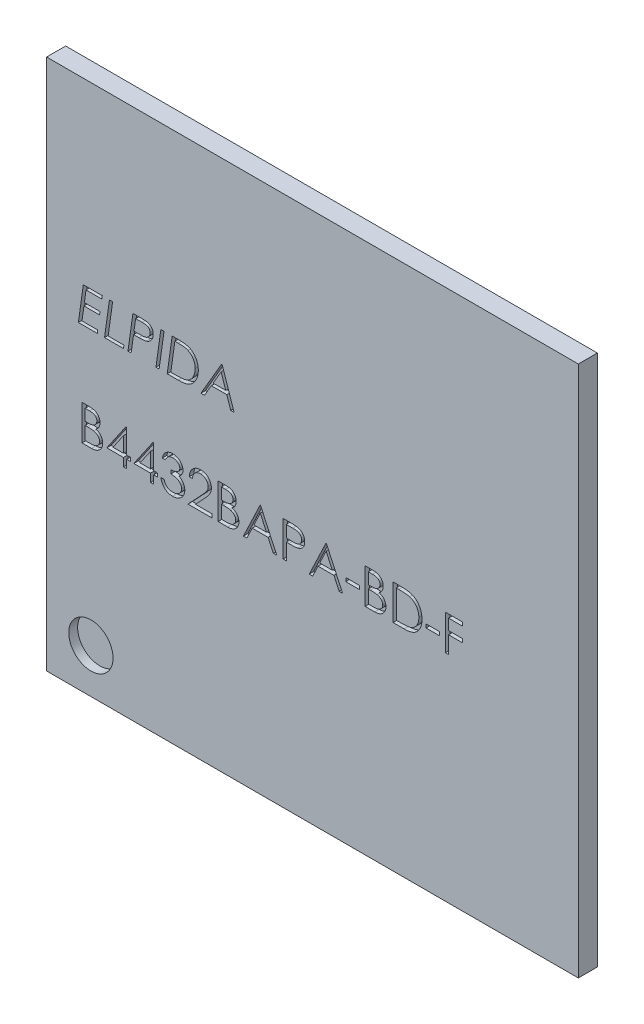
from build123d import *

# Parameters (mm, degrees)
SKETCH1_W           = 12
SKETCH1_H           = 12
BOSS_EXTRUDE1_DEPTH = 0.43
SKETCH5_R           = 0.5
CUT_EXTRUDE2_DEPTH  = 0.2
SKETCH4_W           = 0.305288462
SKETCH4_H           = 0.081410257
CUT_EXTRUDE1_DEPTH  = 0.1


with BuildPart() as part:
    # Sketch1 → Boss-Extrude1 (new body)
    with BuildSketch(Plane.XY):
        Rectangle(SKETCH1_W, SKETCH1_H)
    extrude(amount=BOSS_EXTRUDE1_DEPTH)

    # Sketch5 → Cut-Extrude2 (cut)
    with BuildSketch(Plane.XY.offset(0.43)):
        with Locations((-5, -5)):
            Circle(SKETCH5_R)
    extrude(amount=-CUT_EXTRUDE2_DEPTH, mode=Mode.SUBTRACT)

    # Sketch4 → Cut-Extrude1 (cut)
    # profile 1 of 20: a face of its own
    with BuildSketch(Plane.XY.offset(0.43)):
        Polygon((-4.743704935, 1.963617746), (-4.754994248, 1.892383771), (-5.110051089, 1.892383771), (-5.147099115, 1.627800438), (-4.794586345, 1.627800438), (-4.804762627, 1.556566464), (-5.157275397, 1.556566464), (-5.201319618, 1.24110172), (-4.845467755, 1.24110172), (-4.854690011, 1.169867746), (-5.283047883, 1.169867746), (-5.171744798, 1.963617746), align=None)
    # profile 2 of 20: a face of its own
    with BuildSketch(Plane.XY.offset(0.43)):
        Polygon((-4.58152044, 1.963617746), (-4.509650448, 1.963617746), (-4.611095259, 1.24110172), (-4.255243396, 1.24110172), (-4.264306647, 1.169867746), (-4.692823524, 1.169867746), align=None)
    # profile 3 of 20: a face of its own
    with BuildSketch(Plane.XY.offset(0.43)):
        with BuildLine():
            Line((-4.052353773, 1.963617746), (-3.84262696, 1.963617746))
            add(Edge.make_bspline(
                [(-3.84262696, 1.963617746), (-3.834251572, 1.963565486), (-3.818130989, 1.963464899), (-3.794910318, 1.962458826), (-3.773483707, 1.961071743), (-3.753882184, 1.95913798), (-3.736129443, 1.95619807), (-3.720256434, 1.952906663), (-3.706098841, 1.949213847), (-3.689950424, 1.943061618), (-3.671753119, 1.933628638), (-3.652183986, 1.919467172), (-3.63517565, 1.902059789), (-3.620323246, 1.882224392), (-3.608405471, 1.85982962), (-3.599943126, 1.835257794), (-3.59475202, 1.808805821), (-3.594113096, 1.790486229), (-3.593785063, 1.781080686)],
                knots=[0, 0, 0, 0, 1.135332684, 2.185238988, 3.150208107, 4.046040219, 4.854001743, 5.588181339, 6.243560949, 6.834748932, 7.927376448, 9.012417828, 10.094600696, 11.214043572, 12.361542901, 13.518161337, 14.725788303, 16, 16, 16, 16], degree=3))
            add(Edge.make_bspline(
                [(-3.593785063, 1.781080686), (-3.59388998, 1.774820536), (-3.594095973, 1.762529418), (-3.596239407, 1.744392989), (-3.599736032, 1.726909764), (-3.604523147, 1.71000449), (-3.61055108, 1.693615103), (-3.618196489, 1.677952312), (-3.627217571, 1.662908826), (-3.637281696, 1.648486412), (-3.64857898, 1.635096015), (-3.66051249, 1.62258808), (-3.673278391, 1.611263658), (-3.686810286, 1.601093808), (-3.701005, 1.592012742), (-3.715832489, 1.583968917), (-3.731529602, 1.57729534), (-3.742375043, 1.573666329), (-3.747860333, 1.571830887)],
                knots=[0, 0, 0, 0, 1.077613652, 2.115775993, 3.139637116, 4.14510796, 5.138576732, 6.142762576, 7.14141659, 8.156821813, 9.16766358, 10.155287502, 11.131543445, 12.102666116, 13.067290607, 14.031007908, 15.004144336, 16, 16, 16, 16], degree=3))
            add(Edge.make_bspline(
                [(-3.747860333, 1.571830887), (-3.752300896, 1.570618856), (-3.761856384, 1.56801073), (-3.777455417, 1.564849316), (-3.795370387, 1.5624562), (-3.815554057, 1.560124587), (-3.838165107, 1.558721735), (-3.863070085, 1.557330089), (-3.890273681, 1.556831253), (-3.909143923, 1.556657005), (-3.918949075, 1.556566464)],
                knots=[0, 0, 0, 0, 0.641206386, 1.379788876, 2.215232503, 3.158725674, 4.209900022, 5.370746801, 6.633815758, 8, 8, 8, 8], degree=3))
            Line((-3.918949075, 1.556566464), (-4.037725367, 1.556566464))
            Line((-4.037725367, 1.556566464), (-4.09194587, 1.169867746))
            Line((-4.09194587, 1.169867746), (-4.163656858, 1.169867746))
            Line((-4.163656858, 1.169867746), (-4.052353773, 1.963617746))
        make_face()
        with BuildLine():
            Line((-3.990660063, 1.892383771), (-4.02770809, 1.627800438))
            Line((-4.02770809, 1.627800438), (-3.916405005, 1.627800438))
            add(Edge.make_bspline(
                [(-3.916405005, 1.627800438), (-3.907394849, 1.627890427), (-3.890114406, 1.628063014), (-3.865242008, 1.628565752), (-3.842561892, 1.629946725), (-3.822019821, 1.631379898), (-3.80366729, 1.633619686), (-3.787500423, 1.636329094), (-3.77336409, 1.639199642), (-3.75767066, 1.644042743), (-3.74023586, 1.651684755), (-3.721605902, 1.663766731), (-3.705030221, 1.678525115), (-3.690946588, 1.695939194), (-3.679378954, 1.71511937), (-3.670995651, 1.735759863), (-3.665873257, 1.757456902), (-3.665305697, 1.772307823), (-3.665019037, 1.779808651)],
                knots=[0, 0, 0, 0, 1.292499712, 2.478866002, 3.567711026, 4.55136461, 5.4320969, 6.218239379, 6.902667729, 7.499057556, 8.571240445, 9.621392161, 10.671323708, 11.74113212, 12.821985709, 13.872330035, 14.925367204, 16, 16, 16, 16], degree=3))
            add(Edge.make_bspline(
                [(-3.665019037, 1.779808651), (-3.665217166, 1.785919446), (-3.665599438, 1.797709644), (-3.668988978, 1.814731814), (-3.674768765, 1.83024769), (-3.682551087, 1.844334234), (-3.692322827, 1.856699465), (-3.703935192, 1.867174808), (-3.717294165, 1.875699883), (-3.729950427, 1.881042416), (-3.741469524, 1.884339849), (-3.751819808, 1.886575987), (-3.763848377, 1.888182423), (-3.777454248, 1.889879899), (-3.792748404, 1.890820117), (-3.809646448, 1.891900373), (-3.828209026, 1.892281084), (-3.841143025, 1.892348623), (-3.847874105, 1.892383771)],
                knots=[0, 0, 0, 0, 1.185493767, 2.287297747, 3.351910597, 4.388303413, 5.399095946, 6.397186861, 7.410490164, 8.461641879, 9.051030142, 9.735191633, 10.515167525, 11.40603511, 12.396458938, 13.488902119, 14.693180664, 16, 16, 16, 16], degree=3))
            Line((-3.847874105, 1.892383771), (-3.990660063, 1.892383771))
        make_face(mode=Mode.SUBTRACT)
    # profile 4 of 20: a face of its own
    with BuildSketch(Plane.XY.offset(0.43)):
        Polygon((-3.421424286, 1.963617746), (-3.349713298, 1.963617746), (-3.461016383, 1.169867746), (-3.532727371, 1.169867746), align=None)
    # profile 5 of 20: a face of its own
    with BuildSketch(Plane.XY.offset(0.43)):
        with BuildLine():
            Line((-3.167017234, 1.963617746), (-3.002129664, 1.963617746))
            add(Edge.make_bspline(
                [(-3.002129664, 1.963617746), (-2.989459061, 1.963518111), (-2.964841844, 1.963324535), (-2.929091071, 1.961192203), (-2.895608084, 1.957922454), (-2.864403251, 1.953324953), (-2.835419977, 1.947578541), (-2.808778613, 1.940204876), (-2.784341554, 1.931773318), (-2.7621473, 1.921556197), (-2.74156167, 1.910124393), (-2.722047759, 1.897394447), (-2.703689823, 1.8830426), (-2.686169154, 1.867453704), (-2.670058974, 1.850101621), (-2.654468902, 1.831709558), (-2.640221451, 1.811595877), (-2.627053725, 1.790186764), (-2.615198275, 1.767648943), (-2.604586157, 1.744303167), (-2.595976768, 1.720037378), (-2.588483732, 1.695151292), (-2.583016884, 1.66934151), (-2.579059394, 1.642792241), (-2.5765938, 1.615444672), (-2.576304005, 1.59695877), (-2.576156858, 1.587572323)],
                knots=[0, 0, 0, 0, 1.407956197, 2.735462629, 3.978575056, 5.14562376, 6.239569826, 7.259868312, 8.215552976, 9.109099244, 9.971265144, 10.830589362, 11.695387039, 12.558759329, 13.433767108, 14.324435478, 15.23648578, 16.169930002, 17.115835343, 18.064962916, 19.017083207, 19.975070357, 20.951299687, 21.945924981, 22.957017783, 24, 24, 24, 24], degree=3))
            add(Edge.make_bspline(
                [(-2.576156858, 1.587572323), (-2.576353649, 1.577549605), (-2.576744818, 1.557627135), (-2.579469096, 1.528032425), (-2.584120456, 1.4990498), (-2.590450631, 1.470609824), (-2.598773773, 1.442803857), (-2.608754102, 1.415511792), (-2.620791434, 1.388908625), (-2.634343599, 1.363060989), (-2.649190898, 1.338355527), (-2.66512704, 1.315301545), (-2.681757047, 1.293874567), (-2.699505024, 1.274469086), (-2.717909481, 1.256733532), (-2.737251775, 1.240943397), (-2.757365607, 1.226864606), (-2.778556468, 1.214408107), (-2.801636338, 1.20379345), (-2.826969265, 1.194531557), (-2.855062414, 1.187089568), (-2.885625434, 1.18070832), (-2.918812697, 1.175826452), (-2.95463865, 1.172460696), (-2.993088301, 1.170111191), (-3.019616335, 1.169950566), (-3.033294528, 1.169867746)],
                knots=[0, 0, 0, 0, 1.023590641, 2.03462318, 3.032234983, 4.019795062, 5.008022507, 5.994484159, 6.985450496, 7.987853078, 8.973750197, 9.927208411, 10.848723504, 11.741556299, 12.6106407, 13.456920821, 14.288848772, 15.116061311, 15.963690692, 16.879848279, 17.867349015, 18.92897855, 20.067338715, 21.291093664, 22.603253266, 24, 24, 24, 24], degree=3))
            Line((-3.033294528, 1.169867746), (-3.278320319, 1.169867746))
            Line((-3.278320319, 1.169867746), (-3.167017234, 1.963617746))
        make_face()
        with BuildLine():
            Line((-3.105323524, 1.892383771), (-3.196592054, 1.24110172))
            Line((-3.196592054, 1.24110172), (-3.126948124, 1.24110172))
            add(Edge.make_bspline(
                [(-3.126948124, 1.24110172), (-3.11412186, 1.241151266), (-3.089581976, 1.241246061), (-3.054490193, 1.241435867), (-3.022743205, 1.242311401), (-2.99444104, 1.243261387), (-2.969458117, 1.244226106), (-2.94794898, 1.245909496), (-2.929734352, 1.247479882), (-2.918805789, 1.249111762), (-2.913882218, 1.249846963)],
                knots=[0, 0, 0, 0, 1.442493111, 2.759853895, 3.946400474, 5.013958638, 5.944757951, 6.757596782, 7.440268535, 8, 8, 8, 8], degree=3))
            add(Edge.make_bspline(
                [(-2.913882218, 1.249846963), (-2.90104897, 1.252348072), (-2.876133125, 1.257203993), (-2.840701032, 1.26851719), (-2.808578752, 1.283241786), (-2.783992991, 1.298042231), (-2.766123196, 1.311952753), (-2.753161899, 1.323425918), (-2.740808038, 1.336195994), (-2.728813282, 1.350068081), (-2.717380884, 1.365229239), (-2.706409062, 1.381559506), (-2.69615525, 1.399185761), (-2.686051774, 1.417606918), (-2.677162843, 1.437047971), (-2.669056699, 1.456987294), (-2.66249983, 1.477492826), (-2.656864502, 1.49832248), (-2.652546279, 1.519616434), (-2.649561273, 1.541338058), (-2.647789192, 1.563533119), (-2.647524441, 1.578452906), (-2.647390832, 1.585982279)],
                knots=[0, 0, 0, 0, 1.66921684, 3.240796505, 4.737423238, 6.174950648, 6.894049088, 7.627787166, 8.384256673, 9.161939998, 9.968982309, 10.808348516, 11.67339838, 12.573072656, 13.490905661, 14.402399116, 15.320906089, 16.23893884, 17.15777014, 18.094193054, 19.038221359, 20, 20, 20, 20], degree=3))
            add(Edge.make_bspline(
                [(-2.647390832, 1.585982279), (-2.647493433, 1.593884711), (-2.64769556, 1.609452691), (-2.649878069, 1.632383954), (-2.653129357, 1.654550978), (-2.657932604, 1.675963069), (-2.664137979, 1.696617951), (-2.67162925, 1.716537478), (-2.680341791, 1.735726205), (-2.690622176, 1.753953661), (-2.701750909, 1.771455499), (-2.714319999, 1.787682668), (-2.727574337, 1.802997358), (-2.741995482, 1.817014347), (-2.757300392, 1.829998262), (-2.773728961, 1.841712231), (-2.791097608, 1.852509182), (-2.803374092, 1.858612795), (-2.809575327, 1.861695921)],
                knots=[0, 0, 0, 0, 1.120622261, 2.207652496, 3.264547841, 4.296931978, 5.317338296, 6.321354955, 7.313791919, 8.303262802, 9.287578962, 10.252963919, 11.212004547, 12.158348376, 13.10268917, 14.056203162, 15.018127421, 16, 16, 16, 16], degree=3))
            add(Edge.make_bspline(
                [(-2.809575327, 1.861695921), (-2.815363009, 1.864195775), (-2.827620369, 1.869490057), (-2.848040269, 1.875458509), (-2.871048732, 1.88091625), (-2.896940624, 1.885077231), (-2.925537595, 1.888376874), (-2.956940666, 1.890705841), (-2.99109191, 1.892135982), (-3.014795505, 1.892299128), (-3.027093356, 1.892383771)],
                knots=[0, 0, 0, 0, 0.683593997, 1.447740037, 2.304372588, 3.249017606, 4.291364313, 5.427749439, 6.665470115, 8, 8, 8, 8], degree=3))
            Line((-3.027093356, 1.892383771), (-3.105323524, 1.892383771))
        make_face(mode=Mode.SUBTRACT)
    # profile 6 of 20: a face of its own
    with BuildSketch(Plane.XY.offset(0.43)):
        Polygon((-2.037767936, 1.963617746), (-1.769686505, 1.169867746), (-1.844259572, 1.169867746), (-1.933779053, 1.434451079), (-2.283111736, 1.434451079), (-2.436868997, 1.169867746), (-2.517643236, 1.169867746), (-2.056053442, 1.963617746), align=None)
        Polygon((-2.062254614, 1.814630616), (-2.24177059, 1.505685053), (-1.957947723, 1.505685053), align=None, mode=Mode.SUBTRACT)
    # profile 7 of 20: a face of its own
    with BuildSketch(Plane.XY.offset(0.43)):
        with BuildLine():
            Line((-5.201637627, -0.349122639), (-5.046767335, -0.349122639))
            add(Edge.make_bspline(
                [(-5.046767335, -0.349122639), (-5.039186233, -0.349162497), (-5.024492172, -0.349239751), (-5.003124549, -0.350437889), (-4.983110979, -0.352071579), (-4.964445659, -0.35466376), (-4.947137214, -0.357791538), (-4.931133482, -0.361579272), (-4.916485354, -0.366121022), (-4.898997287, -0.373343303), (-4.879058137, -0.384075522), (-4.857468502, -0.399934321), (-4.839007183, -0.419331862), (-4.823089929, -0.44121275), (-4.810435032, -0.465282827), (-4.801279852, -0.490968393), (-4.795483691, -0.517938145), (-4.7948876, -0.536453652), (-4.794586345, -0.54581109)],
                knots=[0, 0, 0, 0, 1.001505555, 1.941167018, 2.826882275, 3.653841531, 4.429895133, 5.150066043, 5.825578002, 6.45369114, 7.647487171, 8.808567382, 9.977351308, 11.170798116, 12.373658725, 13.556498008, 14.765093433, 16, 16, 16, 16], degree=3))
            add(Edge.make_bspline(
                [(-4.794586345, -0.54581109), (-4.794834271, -0.554576938), (-4.79532147, -0.571802655), (-4.799980274, -0.596997212), (-4.807273854, -0.620980077), (-4.817412366, -0.643663725), (-4.830589069, -0.664535634), (-4.846205152, -0.683764175), (-4.865045784, -0.700535218), (-4.879161662, -0.709911198), (-4.886331888, -0.714673771)],
                knots=[0, 0, 0, 0, 1.044552857, 2.05264487, 3.044412934, 4.028983338, 5.005914585, 5.980388656, 6.974128949, 8, 8, 8, 8], degree=3))
            add(Edge.make_bspline(
                [(-4.886331888, -0.714673771), (-4.877314791, -0.718135654), (-4.860062851, -0.724759095), (-4.836321559, -0.736469281), (-4.815866656, -0.749206045), (-4.798540875, -0.763115233), (-4.783723228, -0.778107767), (-4.770784436, -0.79440348), (-4.759744196, -0.812214948), (-4.750284301, -0.831356464), (-4.742902708, -0.851632574), (-4.737374601, -0.872853089), (-4.734206983, -0.894941917), (-4.733756214, -0.909974494), (-4.733528653, -0.917563394)],
                knots=[0, 0, 0, 0, 1.27268992, 2.434971085, 3.483601985, 4.442670788, 5.356604649, 6.2567628, 7.179492994, 8.113709626, 9.066344395, 10.018646069, 10.999752585, 12, 12, 12, 12], degree=3))
            add(Edge.make_bspline(
                [(-4.733528653, -0.917563394), (-4.733750187, -0.925311953), (-4.734186063, -0.940557458), (-4.737401878, -0.962953712), (-4.742846801, -0.984356602), (-4.750346864, -1.004904563), (-4.760135461, -1.024557843), (-4.772048052, -1.043338709), (-4.786251996, -1.061058459), (-4.802141254, -1.077913995), (-4.820116776, -1.093069582), (-4.839510528, -1.106566894), (-4.860566747, -1.117667162), (-4.88293961, -1.126991688), (-4.906880089, -1.134114392), (-4.93228068, -1.139097458), (-4.959119477, -1.142455029), (-4.977536688, -1.142731073), (-4.986981678, -1.142872639)],
                knots=[0, 0, 0, 0, 0.978564426, 1.925352924, 2.850884081, 3.763762016, 4.682927383, 5.618979971, 6.567305752, 7.547517671, 8.540179244, 9.531824382, 10.526200242, 11.540722885, 12.589160233, 13.674978461, 14.80764778, 16, 16, 16, 16], degree=3))
            Line((-4.986981678, -1.142872639), (-5.201637627, -1.142872639))
            Line((-5.201637627, -1.142872639), (-5.201637627, -0.349122639))
        make_face()
        with BuildLine():
            Line((-5.130403653, -0.430532895), (-5.130403653, -0.684939947))
            Line((-5.130403653, -0.684939947), (-5.082543326, -0.684939947))
            add(Edge.make_bspline(
                [(-5.082543326, -0.684939947), (-5.07554726, -0.68484925), (-5.062029435, -0.684674005), (-5.042453315, -0.684172011), (-5.024282106, -0.682766383), (-5.007547172, -0.681361159), (-4.992274868, -0.679076387), (-4.978499028, -0.676356745), (-4.966003453, -0.673480443), (-4.951593592, -0.668588792), (-4.935248477, -0.66135939), (-4.917823827, -0.650139885), (-4.902462616, -0.636776683), (-4.889491111, -0.621357304), (-4.878874939, -0.604378723), (-4.871501292, -0.586111841), (-4.866501283, -0.567011918), (-4.866049633, -0.553899564), (-4.865820319, -0.54724213)],
                knots=[0, 0, 0, 0, 1.156816544, 2.235205308, 3.236616184, 4.169592532, 5.011045266, 5.787822928, 6.49130361, 7.128639758, 8.301311294, 9.436451833, 10.541879658, 11.654887649, 12.756523258, 13.837046038, 14.901820046, 16, 16, 16, 16], degree=3))
            add(Edge.make_bspline(
                [(-4.865820319, -0.54724213), (-4.865939649, -0.542836643), (-4.866173729, -0.534194798), (-4.868090817, -0.521596998), (-4.871349177, -0.509748861), (-4.875534348, -0.498488018), (-4.881382854, -0.488166581), (-4.888268853, -0.478427677), (-4.896588644, -0.469602965), (-4.906058606, -0.461354882), (-4.916946276, -0.454042284), (-4.929245158, -0.447637682), (-4.943121649, -0.442480399), (-4.958341886, -0.4379637), (-4.97514015, -0.434791355), (-4.993322594, -0.432148533), (-5.013038146, -0.430803072), (-5.026678196, -0.430624963), (-5.033728973, -0.430532895)],
                knots=[0, 0, 0, 0, 0.91205012, 1.789085906, 2.630437955, 3.453916878, 4.269457761, 5.079663411, 5.91843418, 6.774407191, 7.675494373, 8.627863946, 9.638891023, 10.736472738, 11.911756761, 13.175263542, 14.539845004, 16, 16, 16, 16], degree=3))
            Line((-5.033728973, -0.430532895), (-5.130403653, -0.430532895))
        make_face(mode=Mode.SUBTRACT)
        with BuildLine():
            Line((-5.130403653, -0.766350203), (-5.130403653, -1.061462382))
            Line((-5.130403653, -1.061462382), (-5.028958841, -1.061462382))
            add(Edge.make_bspline(
                [(-5.028958841, -1.061462382), (-5.021697406, -1.061375354), (-5.007701947, -1.061207618), (-4.987495061, -1.060660032), (-4.968766393, -1.059414462), (-4.951601405, -1.057453707), (-4.935814749, -1.055326809), (-4.921595806, -1.05246675), (-4.908829313, -1.049189932), (-4.894026033, -1.044124861), (-4.877356487, -1.036256197), (-4.859392597, -1.024392078), (-4.843420936, -1.010258042), (-4.829857958, -0.993899781), (-4.818742512, -0.976112677), (-4.810656365, -0.957256499), (-4.805669152, -0.937642817), (-4.80506541, -0.924270009), (-4.804762627, -0.917563394)],
                knots=[0, 0, 0, 0, 1.160039823, 2.235823828, 3.228722157, 4.157150951, 4.99529583, 5.772374946, 6.472645482, 7.099169577, 8.269452708, 9.405989375, 10.527446681, 11.663510218, 12.788923519, 13.866172445, 14.929861265, 16, 16, 16, 16], degree=3))
            add(Edge.make_bspline(
                [(-4.804762627, -0.917563394), (-4.804825244, -0.913369369), (-4.804949467, -0.905048968), (-4.806822856, -0.89282163), (-4.80954743, -0.880977548), (-4.813069737, -0.869484561), (-4.818199509, -0.858550456), (-4.824188137, -0.847958982), (-4.83120974, -0.83769614), (-4.842150828, -0.824721218), (-4.858064831, -0.809772181), (-4.880676904, -0.795135997), (-4.906388121, -0.783332298), (-4.925036142, -0.778320453), (-4.934669228, -0.775731463)],
                knots=[0, 0, 0, 0, 0.723448775, 1.435228256, 2.130040452, 2.821711965, 3.505591119, 4.210454504, 4.921174351, 5.648778258, 7.137944449, 8.670945889, 10.280296675, 12, 12, 12, 12], degree=3))
            add(Edge.make_bspline(
                [(-4.934669228, -0.775731463), (-4.938531183, -0.774947899), (-4.9469047, -0.773248972), (-4.960558919, -0.771455617), (-4.976147232, -0.769857898), (-4.993705635, -0.768676082), (-5.013256341, -0.767454491), (-5.034841107, -0.766979416), (-5.058371784, -0.766412619), (-5.074698625, -0.766371541), (-5.083179344, -0.766350203)],
                knots=[0, 0, 0, 0, 0.634451884, 1.375622551, 2.216452059, 3.157844607, 4.20941857, 5.370758133, 6.634282058, 8, 8, 8, 8], degree=3))
            Line((-5.083179344, -0.766350203), (-5.130403653, -0.766350203))
        make_face(mode=Mode.SUBTRACT)
    # profile 8 of 20: a face of its own
    with BuildSketch(Plane.XY.offset(0.43)):
        Polygon((-4.208655105, -0.328770075), (-4.194185704, -0.328770075), (-4.194185704, -0.878289306), (-4.102599165, -0.878289306), (-4.102599165, -0.959699562), (-4.194185704, -0.959699562), (-4.194185704, -1.142872639), (-4.265419678, -1.142872639), (-4.265419678, -0.959699562), (-4.641942114, -0.959699562), align=None)
        Polygon((-4.265419678, -0.878289306), (-4.265419678, -0.533567751), (-4.502018236, -0.878289306), align=None, mode=Mode.SUBTRACT)
    # profile 9 of 20: a face of its own
    with BuildSketch(Plane.XY.offset(0.43)):
        Polygon((-3.598078182, -0.328770075), (-3.583608781, -0.328770075), (-3.583608781, -0.878289306), (-3.492022242, -0.878289306), (-3.492022242, -0.959699562), (-3.583608781, -0.959699562), (-3.583608781, -1.142872639), (-3.654842755, -1.142872639), (-3.654842755, -0.959699562), (-4.031365191, -0.959699562), align=None)
        Polygon((-3.654842755, -0.878289306), (-3.654842755, -0.533567751), (-3.891441313, -0.878289306), align=None, mode=Mode.SUBTRACT)
    # profile 10 of 20: a face of its own
    with BuildSketch(Plane.XY.offset(0.43)):
        with BuildLine():
            Line((-3.319025448, -0.532295716), (-3.390259422, -0.532295716))
            add(Edge.make_bspline(
                [(-3.390259422, -0.532295716), (-3.388329577, -0.524305492), (-3.384556889, -0.508685257), (-3.376687975, -0.486367896), (-3.368115644, -0.465248812), (-3.357822044, -0.445723452), (-3.346594165, -0.427399416), (-3.333730262, -0.410692311), (-3.319823825, -0.395177227), (-3.304442096, -0.381408332), (-3.288311131, -0.368940169), (-3.271203637, -0.358309575), (-3.253463803, -0.349164634), (-3.234968717, -0.34163076), (-3.215663317, -0.335955328), (-3.195722135, -0.331837624), (-3.175092913, -0.329163568), (-3.161089441, -0.328902591), (-3.153978873, -0.328770075)],
                knots=[0, 0, 0, 0, 1.162005537, 2.271625781, 3.343758855, 4.383309926, 5.390229558, 6.379919256, 7.361854164, 8.333198761, 9.295911338, 10.242430842, 11.177959212, 12.116337295, 13.062827104, 14.020064771, 14.994644689, 16, 16, 16, 16], degree=3))
            add(Edge.make_bspline(
                [(-3.153978873, -0.328770075), (-3.14361868, -0.329082864), (-3.123124279, -0.329701621), (-3.093015517, -0.335351859), (-3.063980863, -0.344292916), (-3.036338123, -0.356646779), (-3.0106618, -0.371883902), (-2.987816272, -0.390018762), (-2.968111199, -0.410701461), (-2.951579795, -0.433546167), (-2.938636001, -0.457960899), (-2.929091412, -0.483088792), (-2.923280781, -0.508870239), (-2.922527726, -0.526277693), (-2.922150448, -0.534998791)],
                knots=[0, 0, 0, 0, 1.083050992, 2.142477498, 3.193116406, 4.255571735, 5.30263384, 6.308962982, 7.297363603, 8.282367274, 9.249857812, 10.179914175, 11.08814088, 12, 12, 12, 12], degree=3))
            add(Edge.make_bspline(
                [(-2.922150448, -0.534998791), (-2.922414333, -0.543391403), (-2.922930717, -0.559814443), (-2.927315325, -0.583790568), (-2.934694085, -0.60638786), (-2.944915263, -0.627701445), (-2.958146293, -0.647596185), (-2.974173851, -0.666116843), (-2.993111062, -0.683345562), (-3.007461821, -0.693215157), (-3.014850017, -0.698296317)],
                knots=[0, 0, 0, 0, 1.024540389, 2.004866551, 2.965041327, 3.920577974, 4.882998113, 5.874504559, 6.905732034, 8, 8, 8, 8], degree=3))
            add(Edge.make_bspline(
                [(-3.014850017, -0.698296317), (-3.006406387, -0.702373509), (-2.989677114, -0.710451607), (-2.96687369, -0.726293895), (-2.946173172, -0.744585602), (-2.934628935, -0.758860096), (-2.928828633, -0.766032194)],
                knots=[0, 0, 0, 0, 1.015518401, 2.012035669, 3.001164323, 4, 4, 4, 4], degree=3))
            add(Edge.make_bspline(
                [(-2.928828633, -0.766032194), (-2.925009257, -0.771261363), (-2.91743305, -0.781634069), (-2.90808142, -0.79831108), (-2.899597567, -0.815172935), (-2.892986714, -0.832671586), (-2.887867283, -0.850604216), (-2.884207862, -0.869001617), (-2.88193453, -0.887878811), (-2.881608967, -0.900649677), (-2.881445319, -0.907069103)],
                knots=[0, 0, 0, 0, 1.025084078, 2.033381695, 3.024893161, 4.013698104, 4.991890475, 5.976764909, 6.982997093, 8, 8, 8, 8], degree=3))
            add(Edge.make_bspline(
                [(-2.881445319, -0.907069103), (-2.881852289, -0.918183808), (-2.882664314, -0.940360911), (-2.889922381, -0.973125714), (-2.901173955, -1.00515364), (-2.917152582, -1.035786684), (-2.936626106, -1.064447949), (-2.959793928, -1.090092041), (-2.98639281, -1.112135296), (-3.016057662, -1.130552615), (-3.048197083, -1.145275073), (-3.082572261, -1.155493457), (-3.118687899, -1.162148711), (-3.143454554, -1.162862375), (-3.15604593, -1.163225203)],
                knots=[0, 0, 0, 0, 0.955779014, 1.907060117, 2.875433937, 3.871313158, 4.872415639, 5.851225146, 6.836215519, 7.83643374, 8.849228613, 9.86973379, 10.916971861, 12, 12, 12, 12], degree=3))
            add(Edge.make_bspline(
                [(-3.15604593, -1.163225203), (-3.164532093, -1.163028305), (-3.181230032, -1.162640874), (-3.205778111, -1.159992334), (-3.229209996, -1.155154994), (-3.251557369, -1.148645494), (-3.272840083, -1.140392367), (-3.292993192, -1.130114734), (-3.312140686, -1.118024447), (-3.330101877, -1.103978794), (-3.346874623, -1.088266776), (-3.362013188, -1.070609464), (-3.375769962, -1.051333267), (-3.387776596, -1.030214289), (-3.398579976, -1.007525453), (-3.407465658, -0.98297624), (-3.415286492, -0.956786114), (-3.418922653, -0.938534912), (-3.420788268, -0.929170716)],
                knots=[0, 0, 0, 0, 1.048658725, 2.063410685, 3.046034179, 4.001477787, 4.936774919, 5.862367409, 6.792675028, 7.730719943, 8.675894397, 9.627829632, 10.600096036, 11.597688215, 12.626045268, 13.701542398, 14.82072376, 16, 16, 16, 16], degree=3))
            Line((-3.420788268, -0.929170716), (-3.349554294, -0.929170716))
            add(Edge.make_bspline(
                [(-3.349554294, -0.929170716), (-3.34769844, -0.935282367), (-3.344088644, -0.947170059), (-3.337944044, -0.964278843), (-3.330943561, -0.979962902), (-3.323433652, -0.994337288), (-3.315546397, -1.007543565), (-3.306721048, -1.019232525), (-3.29761126, -1.02991758), (-3.290744335, -1.035937518), (-3.287383571, -1.038883757)],
                knots=[0, 0, 0, 0, 1.198163088, 2.33053128, 3.407730985, 4.417276592, 5.372219308, 6.28897303, 7.162600585, 8, 8, 8, 8], degree=3))
            add(Edge.make_bspline(
                [(-3.287383571, -1.038883757), (-3.282939347, -1.042310111), (-3.274064618, -1.049152243), (-3.259602894, -1.057883862), (-3.244393536, -1.065449666), (-3.228106994, -1.071229005), (-3.211094716, -1.07612251), (-3.193081724, -1.079324842), (-3.174226937, -1.081521981), (-3.161352819, -1.081715867), (-3.154773895, -1.081814947)],
                knots=[0, 0, 0, 0, 0.946170439, 1.889420265, 2.845303464, 3.807233317, 4.801018734, 5.828864929, 6.890507805, 8, 8, 8, 8], degree=3))
            add(Edge.make_bspline(
                [(-3.154773895, -1.081814947), (-3.147345869, -1.081675268), (-3.132821004, -1.081402139), (-3.111626777, -1.078890327), (-3.091463838, -1.075232179), (-3.072556049, -1.069582271), (-3.054655738, -1.062601613), (-3.038013828, -1.053836707), (-3.022411854, -1.043553172), (-3.00804965, -1.031864827), (-2.995135222, -1.019069238), (-2.983764297, -1.005685917), (-2.974097632, -0.991771291), (-2.966299928, -0.97724836), (-2.960142571, -0.962177263), (-2.955950845, -0.946515707), (-2.953036305, -0.930391863), (-2.952798949, -0.919431543), (-2.952679294, -0.913906293)],
                knots=[0, 0, 0, 0, 1.217147791, 2.380027433, 3.494444702, 4.572153297, 5.609568379, 6.639424714, 7.649109417, 8.668170816, 9.669597737, 10.625200337, 11.543417969, 12.441394052, 13.322311151, 14.205496177, 15.095365482, 16, 16, 16, 16], degree=3))
            add(Edge.make_bspline(
                [(-2.952679294, -0.913906293), (-2.953026344, -0.906510507), (-2.953718718, -0.891755736), (-2.959004771, -0.870048357), (-2.967699478, -0.849133405), (-2.979871637, -0.829367717), (-2.994688847, -0.811048896), (-3.012007317, -0.794704114), (-3.031970861, -0.781217146), (-3.05034501, -0.771898826), (-3.066620322, -0.765540418), (-3.080548454, -0.761305203), (-3.09614147, -0.757718892), (-3.113210802, -0.754382359), (-3.131885067, -0.751542696), (-3.152143935, -0.749174641), (-3.173991509, -0.747279837), (-3.189116113, -0.746433678), (-3.196910063, -0.745997639)],
                knots=[0, 0, 0, 0, 1.07054697, 2.135767047, 3.216561865, 4.33974944, 5.486079747, 6.621378074, 7.775625952, 8.963672916, 9.598146892, 10.304877434, 11.070270905, 11.915000392, 12.823868403, 13.805723172, 14.86925407, 16, 16, 16, 16], degree=3))
            Line((-3.196910063, -0.745997639), (-3.196910063, -0.664587382))
            add(Edge.make_bspline(
                [(-3.196910063, -0.664587382), (-3.187089977, -0.664420739), (-3.167854841, -0.664094327), (-3.139757383, -0.660146439), (-3.112889328, -0.654685296), (-3.087846121, -0.646320262), (-3.06502043, -0.636604694), (-3.045217592, -0.625298925), (-3.028715043, -0.612731652), (-3.015592978, -0.598708899), (-3.005721171, -0.583669594), (-2.998503308, -0.567994923), (-2.994239663, -0.551547502), (-2.993670506, -0.540322819), (-2.993384422, -0.534680782)],
                knots=[0, 0, 0, 0, 1.321986639, 2.589447074, 3.816329219, 5.01088745, 6.139805852, 7.153945165, 8.075214402, 8.924034688, 9.728124013, 10.488707548, 11.240355623, 12, 12, 12, 12], degree=3))
            add(Edge.make_bspline(
                [(-2.993384422, -0.534680782), (-2.993478404, -0.53053565), (-2.993665378, -0.522289108), (-2.996023332, -0.510241101), (-2.999566641, -0.498561422), (-3.004437937, -0.48729974), (-3.010958072, -0.47653416), (-3.018760858, -0.4661729), (-3.028051838, -0.456275114), (-3.038698394, -0.447049399), (-3.050131072, -0.43825709), (-3.062660931, -0.430792747), (-3.075910178, -0.424409849), (-3.08989348, -0.419146265), (-3.104656216, -0.415186748), (-3.120129025, -0.412343799), (-3.13634141, -0.41056633), (-3.147402142, -0.410310422), (-3.153024847, -0.410180331)],
                knots=[0, 0, 0, 0, 0.884392785, 1.759457502, 2.611959086, 3.489218968, 4.37281399, 5.2945488, 6.255912374, 7.266815255, 8.301784654, 9.332968512, 10.37626691, 11.440494194, 12.520033166, 13.637162961, 14.798855837, 16, 16, 16, 16], degree=3))
            add(Edge.make_bspline(
                [(-3.153024847, -0.410180331), (-3.162062636, -0.410495872), (-3.17971554, -0.411112197), (-3.20516428, -0.416510381), (-3.228822414, -0.425123267), (-3.246906005, -0.435404149), (-3.260259731, -0.445552908), (-3.26980218, -0.454416235), (-3.279173081, -0.464266179), (-3.28775594, -0.475709417), (-3.296435931, -0.487970993), (-3.30433818, -0.501674221), (-3.312017075, -0.516461646), (-3.316644081, -0.526915477), (-3.319025448, -0.532295716)],
                knots=[0, 0, 0, 0, 1.472543308, 2.876219568, 4.221790263, 5.565193594, 6.249813518, 6.953379497, 7.687249741, 8.463570142, 9.283606569, 10.136032583, 11.040678096, 12, 12, 12, 12], degree=3))
        make_face()
    # profile 11 of 20: a face of its own
    with BuildSketch(Plane.XY.offset(0.43)):
        with BuildLine():
            Line((-2.708448524, -0.593353408), (-2.779682499, -0.593353408))
            add(Edge.make_bspline(
                [(-2.779682499, -0.593353408), (-2.779218234, -0.583903046), (-2.77830643, -0.565342786), (-2.774036443, -0.538281829), (-2.767926636, -0.51241583), (-2.759288039, -0.487952475), (-2.748559651, -0.464675459), (-2.735694091, -0.442677242), (-2.720455486, -0.42204174), (-2.703172887, -0.402960252), (-2.684402142, -0.385455214), (-2.664148831, -0.370338757), (-2.642866119, -0.357566714), (-2.620618577, -0.346889361), (-2.597155199, -0.338874788), (-2.572688908, -0.332928095), (-2.547112211, -0.329350245), (-2.529685992, -0.328965665), (-2.520823324, -0.328770075)],
                knots=[0, 0, 0, 0, 1.10065271, 2.161652631, 3.183658789, 4.190468796, 5.17591951, 6.163126047, 7.15150782, 8.156236427, 9.156009102, 10.134482811, 11.092018607, 12.041330605, 13.001268258, 13.972401359, 14.968799086, 16, 16, 16, 16], degree=3))
            add(Edge.make_bspline(
                [(-2.520823324, -0.328770075), (-2.512119725, -0.328973832), (-2.495017464, -0.329374207), (-2.470056972, -0.332812512), (-2.446294978, -0.338197673), (-2.423777931, -0.345753134), (-2.402685484, -0.355909602), (-2.382859187, -0.368110115), (-2.364063003, -0.382220684), (-2.34714325, -0.398833602), (-2.331606596, -0.416568786), (-2.318203049, -0.43550265), (-2.306724707, -0.45505822), (-2.297157144, -0.475384616), (-2.290114055, -0.496673224), (-2.284766854, -0.518614107), (-2.281744387, -0.541434377), (-2.281280514, -0.556879971), (-2.281044678, -0.564732615)],
                knots=[0, 0, 0, 0, 1.111607364, 2.184268762, 3.212621178, 4.221274766, 5.211760367, 6.196651075, 7.1921475, 8.207485113, 9.220403448, 10.201281604, 11.166441695, 12.114753415, 13.065576456, 14.026450734, 14.996634279, 16, 16, 16, 16], degree=3))
            add(Edge.make_bspline(
                [(-2.281044678, -0.564732615), (-2.281428686, -0.575787927), (-2.282189963, -0.597704547), (-2.288701973, -0.629911489), (-2.298872521, -0.661115711), (-2.311118351, -0.686229349), (-2.323471923, -0.706466231), (-2.334604268, -0.723127884), (-2.347636466, -0.741067874), (-2.362758197, -0.760226127), (-2.379656652, -0.780752707), (-2.398484893, -0.802635214), (-2.419377182, -0.825647562), (-2.434040807, -0.841365083), (-2.441639129, -0.849509508)],
                knots=[0, 0, 0, 0, 1.184426356, 2.348067706, 3.509069118, 4.696110526, 5.333549288, 6.050745305, 6.844228056, 7.710549037, 8.667450064, 9.695053472, 10.805634456, 12, 12, 12, 12], degree=3))
            Line((-2.441639129, -0.849509508), (-2.640235634, -1.061462382))
            Line((-2.640235634, -1.061462382), (-2.270868396, -1.061462382))
            Line((-2.270868396, -1.061462382), (-2.270868396, -1.142872639))
            Line((-2.270868396, -1.142872639), (-2.810211345, -1.142872639))
            Line((-2.810211345, -1.142872639), (-2.502378813, -0.814369534))
            add(Edge.make_bspline(
                [(-2.502378813, -0.814369534), (-2.494884024, -0.806545811), (-2.480488069, -0.79151804), (-2.460126663, -0.769578119), (-2.441838893, -0.749224205), (-2.425506377, -0.730494755), (-2.411483421, -0.713115811), (-2.399039183, -0.697650226), (-2.389068415, -0.683418413), (-2.378247245, -0.666921881), (-2.367766574, -0.646780516), (-2.358760379, -0.622166626), (-2.353268797, -0.596828481), (-2.352610022, -0.579705698), (-2.352278653, -0.571092791)],
                knots=[0, 0, 0, 0, 1.329631726, 2.553950428, 3.673215718, 4.687767853, 5.603093632, 6.413772471, 7.123043292, 7.734684054, 8.834405432, 9.900288307, 10.943827018, 12, 12, 12, 12], degree=3))
            add(Edge.make_bspline(
                [(-2.352278653, -0.571092791), (-2.35242283, -0.565676831), (-2.352706976, -0.555003014), (-2.355214703, -0.539353494), (-2.359004408, -0.524257545), (-2.36443485, -0.509668733), (-2.371602807, -0.495733737), (-2.38032802, -0.482435594), (-2.390395052, -0.469579347), (-2.402040787, -0.457524938), (-2.414834113, -0.446484736), (-2.428349238, -0.436704809), (-2.442648101, -0.428531654), (-2.457670414, -0.421831611), (-2.473374297, -0.416575765), (-2.489790124, -0.412933909), (-2.506872534, -0.410647346), (-2.518536916, -0.410337971), (-2.524480426, -0.410180331)],
                knots=[0, 0, 0, 0, 0.991446411, 1.95395049, 2.89581595, 3.838931463, 4.798493298, 5.75982156, 6.748411868, 7.785213223, 8.824556874, 9.840280684, 10.836137867, 11.835679398, 12.848801643, 13.863922112, 14.911575587, 16, 16, 16, 16], degree=3))
            add(Edge.make_bspline(
                [(-2.524480426, -0.410180331), (-2.530687739, -0.41034249), (-2.542877879, -0.410660944), (-2.560775588, -0.412888584), (-2.577849327, -0.416731658), (-2.594142044, -0.421987797), (-2.609681307, -0.428668575), (-2.624391546, -0.436989739), (-2.638239737, -0.446919209), (-2.651251913, -0.458176978), (-2.663240708, -0.470710881), (-2.673774196, -0.48468314), (-2.682978071, -0.499838643), (-2.691008379, -0.516136497), (-2.697529759, -0.533724586), (-2.702512955, -0.552540476), (-2.706456044, -0.572502468), (-2.707773333, -0.586287657), (-2.708448524, -0.593353408)],
                knots=[0, 0, 0, 0, 1.031018746, 2.02475058, 2.990194455, 3.934040569, 4.864654155, 5.795059489, 6.735614925, 7.690564532, 8.649604399, 9.611025574, 10.590972636, 11.591080095, 12.624614302, 13.701020113, 14.821632451, 16, 16, 16, 16], degree=3))
        make_face()
    # profile 12 of 20: a face of its own
    with BuildSketch(Plane.XY.offset(0.43)):
        with BuildLine():
            Line((-2.128400448, -0.349122639), (-1.973530155, -0.349122639))
            add(Edge.make_bspline(
                [(-1.973530155, -0.349122639), (-1.965949054, -0.349162497), (-1.951254993, -0.349239751), (-1.929887369, -0.350437889), (-1.9098738, -0.352071579), (-1.89120848, -0.35466376), (-1.873900035, -0.357791538), (-1.857896303, -0.361579272), (-1.843248175, -0.366121022), (-1.825760108, -0.373343303), (-1.805820958, -0.384075522), (-1.784231322, -0.399934321), (-1.765770004, -0.419331862), (-1.749852749, -0.44121275), (-1.737197853, -0.465282827), (-1.728042673, -0.490968393), (-1.722246512, -0.517938145), (-1.72165042, -0.536453652), (-1.721349165, -0.54581109)],
                knots=[0, 0, 0, 0, 1.001505555, 1.941167018, 2.826882275, 3.653841531, 4.429895133, 5.150066043, 5.825578002, 6.45369114, 7.647487171, 8.808567382, 9.977351308, 11.170798116, 12.373658725, 13.556498008, 14.765093433, 16, 16, 16, 16], degree=3))
            add(Edge.make_bspline(
                [(-1.721349165, -0.54581109), (-1.721597092, -0.554576938), (-1.72208429, -0.571802655), (-1.726743095, -0.596997212), (-1.734036675, -0.620980077), (-1.744175187, -0.643663725), (-1.75735189, -0.664535634), (-1.772967972, -0.683764175), (-1.791808604, -0.700535218), (-1.805924482, -0.709911198), (-1.813094708, -0.714673771)],
                knots=[0, 0, 0, 0, 1.044552857, 2.05264487, 3.044412934, 4.028983338, 5.005914585, 5.980388656, 6.974128949, 8, 8, 8, 8], degree=3))
            add(Edge.make_bspline(
                [(-1.813094708, -0.714673771), (-1.804077611, -0.718135654), (-1.786825671, -0.724759095), (-1.763084379, -0.736469281), (-1.742629477, -0.749206045), (-1.725303695, -0.763115233), (-1.710486049, -0.778107767), (-1.697547257, -0.79440348), (-1.686507016, -0.812214948), (-1.677047121, -0.831356464), (-1.669665528, -0.851632574), (-1.664137421, -0.872853089), (-1.660969803, -0.894941917), (-1.660519035, -0.909974494), (-1.660291473, -0.917563394)],
                knots=[0, 0, 0, 0, 1.27268992, 2.434971085, 3.483601985, 4.442670788, 5.356604649, 6.2567628, 7.179492994, 8.113709626, 9.066344395, 10.018646069, 10.999752585, 12, 12, 12, 12], degree=3))
            add(Edge.make_bspline(
                [(-1.660291473, -0.917563394), (-1.660513008, -0.925311953), (-1.660948884, -0.940557458), (-1.664164699, -0.962953712), (-1.669609621, -0.984356602), (-1.677109685, -1.004904563), (-1.686898281, -1.024557843), (-1.698810873, -1.043338709), (-1.713014817, -1.061058459), (-1.728904075, -1.077913995), (-1.746879597, -1.093069582), (-1.766273349, -1.106566894), (-1.787329567, -1.117667162), (-1.80970243, -1.126991688), (-1.833642909, -1.134114392), (-1.859043501, -1.139097458), (-1.885882298, -1.142455029), (-1.904299509, -1.142731073), (-1.913744498, -1.142872639)],
                knots=[0, 0, 0, 0, 0.978564426, 1.925352924, 2.850884081, 3.763762016, 4.682927383, 5.618979971, 6.567305752, 7.547517671, 8.540179244, 9.531824382, 10.526200242, 11.540722885, 12.589160233, 13.674978461, 14.80764778, 16, 16, 16, 16], degree=3))
            Line((-1.913744498, -1.142872639), (-2.128400448, -1.142872639))
            Line((-2.128400448, -1.142872639), (-2.128400448, -0.349122639))
        make_face()
        with BuildLine():
            Line((-2.057166473, -0.430532895), (-2.057166473, -0.684939947))
            Line((-2.057166473, -0.684939947), (-2.009306147, -0.684939947))
            add(Edge.make_bspline(
                [(-2.009306147, -0.684939947), (-2.002310081, -0.68484925), (-1.988792255, -0.684674005), (-1.969216136, -0.684172011), (-1.951044926, -0.682766383), (-1.934309993, -0.681361159), (-1.919037688, -0.679076387), (-1.905261848, -0.676356745), (-1.892766274, -0.673480443), (-1.878356413, -0.668588792), (-1.862011297, -0.66135939), (-1.844586647, -0.650139885), (-1.829225437, -0.636776683), (-1.816253932, -0.621357304), (-1.805637759, -0.604378723), (-1.798264113, -0.586111841), (-1.793264104, -0.567011918), (-1.792812453, -0.553899564), (-1.79258314, -0.54724213)],
                knots=[0, 0, 0, 0, 1.156816544, 2.235205308, 3.236616184, 4.169592532, 5.011045266, 5.787822928, 6.49130361, 7.128639758, 8.301311294, 9.436451833, 10.541879658, 11.654887649, 12.756523258, 13.837046038, 14.901820046, 16, 16, 16, 16], degree=3))
            add(Edge.make_bspline(
                [(-1.79258314, -0.54724213), (-1.79270247, -0.542836643), (-1.792936549, -0.534194798), (-1.794853637, -0.521596998), (-1.798111998, -0.509748861), (-1.802297168, -0.498488018), (-1.808145674, -0.488166581), (-1.815031674, -0.478427677), (-1.823351464, -0.469602965), (-1.832821426, -0.461354882), (-1.843709096, -0.454042284), (-1.856007979, -0.447637682), (-1.86988447, -0.442480399), (-1.885104706, -0.4379637), (-1.901902971, -0.434791355), (-1.920085414, -0.432148533), (-1.939800967, -0.430803072), (-1.953441017, -0.430624963), (-1.960491794, -0.430532895)],
                knots=[0, 0, 0, 0, 0.91205012, 1.789085906, 2.630437955, 3.453916878, 4.269457761, 5.079663411, 5.91843418, 6.774407191, 7.675494373, 8.627863946, 9.638891023, 10.736472738, 11.911756761, 13.175263542, 14.539845004, 16, 16, 16, 16], degree=3))
            Line((-1.960491794, -0.430532895), (-2.057166473, -0.430532895))
        make_face(mode=Mode.SUBTRACT)
        with BuildLine():
            Line((-2.057166473, -0.766350203), (-2.057166473, -1.061462382))
            Line((-2.057166473, -1.061462382), (-1.955721661, -1.061462382))
            add(Edge.make_bspline(
                [(-1.955721661, -1.061462382), (-1.948460226, -1.061375354), (-1.934464768, -1.061207618), (-1.914257882, -1.060660032), (-1.895529214, -1.059414462), (-1.878364226, -1.057453707), (-1.862577569, -1.055326809), (-1.848358626, -1.05246675), (-1.835592134, -1.049189932), (-1.820788853, -1.044124861), (-1.804119308, -1.036256197), (-1.786155417, -1.024392078), (-1.770183757, -1.010258042), (-1.756620779, -0.993899781), (-1.745505333, -0.976112677), (-1.737419185, -0.957256499), (-1.732431973, -0.937642817), (-1.731828231, -0.924270009), (-1.731525448, -0.917563394)],
                knots=[0, 0, 0, 0, 1.160039823, 2.235823828, 3.228722157, 4.157150951, 4.99529583, 5.772374946, 6.472645482, 7.099169577, 8.269452708, 9.405989375, 10.527446681, 11.663510218, 12.788923519, 13.866172445, 14.929861265, 16, 16, 16, 16], degree=3))
            add(Edge.make_bspline(
                [(-1.731525448, -0.917563394), (-1.731588064, -0.913369369), (-1.731712287, -0.905048968), (-1.733585677, -0.89282163), (-1.736310251, -0.880977548), (-1.739832558, -0.869484561), (-1.74496233, -0.858550456), (-1.750950957, -0.847958982), (-1.757972561, -0.83769614), (-1.768913648, -0.824721218), (-1.784827652, -0.809772181), (-1.807439724, -0.795135997), (-1.833150942, -0.783332298), (-1.851798962, -0.778320453), (-1.861432048, -0.775731463)],
                knots=[0, 0, 0, 0, 0.723448775, 1.435228256, 2.130040452, 2.821711965, 3.505591119, 4.210454504, 4.921174351, 5.648778258, 7.137944449, 8.670945889, 10.280296675, 12, 12, 12, 12], degree=3))
            add(Edge.make_bspline(
                [(-1.861432048, -0.775731463), (-1.865294004, -0.774947899), (-1.87366752, -0.773248972), (-1.887321739, -0.771455617), (-1.902910053, -0.769857898), (-1.920468455, -0.768676082), (-1.940019162, -0.767454491), (-1.961603927, -0.766979416), (-1.985134604, -0.766412619), (-2.001461446, -0.766371541), (-2.009942164, -0.766350203)],
                knots=[0, 0, 0, 0, 0.634451884, 1.375622551, 2.216452059, 3.157844607, 4.20941857, 5.370758133, 6.634282058, 8, 8, 8, 8], degree=3))
            Line((-2.009942164, -0.766350203), (-2.057166473, -0.766350203))
        make_face(mode=Mode.SUBTRACT)
    # profile 13 of 20: a face of its own
    with BuildSketch(Plane.XY.offset(0.43)):
        Polygon((-1.171829935, -0.349122639), (-0.805483781, -1.142872639), (-0.882918927, -1.142872639), (-1.00026418, -0.888465588), (-1.360091153, -0.888465588), (-1.480775498, -1.142872639), (-1.558528653, -1.142872639), (-1.182006217, -0.349122639), align=None)
        Polygon((-1.177713098, -0.503833927), (-1.321453082, -0.807055331), (-1.03778922, -0.807055331), align=None, mode=Mode.SUBTRACT)
    # profile 14 of 20: a face of its own
    with BuildSketch(Plane.XY.offset(0.43)):
        with BuildLine():
            Line((-0.663015832, -0.349122639), (-0.507350518, -0.349122639))
            add(Edge.make_bspline(
                [(-0.507350518, -0.349122639), (-0.496643759, -0.349134408), (-0.476129133, -0.349156959), (-0.446711611, -0.34984066), (-0.419994047, -0.350753856), (-0.39603405, -0.35201975), (-0.374757899, -0.353515762), (-0.356261869, -0.355613993), (-0.340400576, -0.35780481), (-0.330896792, -0.360032164), (-0.326562507, -0.361047969)],
                knots=[0, 0, 0, 0, 1.415646017, 2.712440637, 3.8905458, 4.950247383, 5.884950622, 6.709939814, 7.411656543, 8, 8, 8, 8], degree=3))
            add(Edge.make_bspline(
                [(-0.326562507, -0.361047969), (-0.321075759, -0.362549733), (-0.310231552, -0.365517873), (-0.294605779, -0.371462771), (-0.279739104, -0.378511762), (-0.265580518, -0.386545406), (-0.25230401, -0.395908382), (-0.239711497, -0.406221149), (-0.227914109, -0.417721808), (-0.216978186, -0.430281369), (-0.206935027, -0.443688988), (-0.198287759, -0.458144815), (-0.19104712, -0.473405521), (-0.184836985, -0.489460492), (-0.180367389, -0.506444547), (-0.177000325, -0.524239677), (-0.174863181, -0.542843972), (-0.174658492, -0.555557549), (-0.174554294, -0.56202954)],
                knots=[0, 0, 0, 0, 0.999701418, 1.975846123, 2.934577507, 3.890451536, 4.834027766, 5.787354733, 6.749476667, 7.726910423, 8.712836071, 9.690891519, 10.682875813, 11.679750201, 12.712814741, 13.765529915, 14.8625177, 16, 16, 16, 16], degree=3))
            add(Edge.make_bspline(
                [(-0.174554294, -0.56202954), (-0.174649867, -0.568555929), (-0.174836862, -0.581325249), (-0.177081198, -0.60000622), (-0.180104295, -0.617858427), (-0.184752734, -0.634842284), (-0.190840949, -0.650856932), (-0.197982897, -0.666147104), (-0.206597019, -0.680452673), (-0.216495043, -0.693825573), (-0.227505851, -0.706278356), (-0.239582856, -0.717720783), (-0.252677303, -0.728085874), (-0.266747576, -0.737396866), (-0.281930845, -0.745437844), (-0.297996834, -0.752639947), (-0.315085186, -0.758688563), (-0.326910363, -0.76187038), (-0.332922683, -0.763488124)],
                knots=[0, 0, 0, 0, 1.121902311, 2.195077645, 3.232258892, 4.234102512, 5.217864754, 6.176164875, 7.132989551, 8.084763148, 9.034132444, 9.988522005, 10.94243251, 11.903244335, 12.886203696, 13.894208494, 14.929344452, 16, 16, 16, 16], degree=3))
            add(Edge.make_bspline(
                [(-0.332922683, -0.763488124), (-0.337895489, -0.764545621), (-0.348793683, -0.766863188), (-0.366742122, -0.769450463), (-0.387639379, -0.771658812), (-0.411456932, -0.773314606), (-0.438173401, -0.7747321), (-0.46780324, -0.775858793), (-0.500404611, -0.776477885), (-0.523144697, -0.776509814), (-0.535017284, -0.776526485)],
                knots=[0, 0, 0, 0, 0.601384939, 1.31797006, 2.144135048, 3.087295005, 4.142315834, 5.309527816, 6.595305764, 8, 8, 8, 8], degree=3))
            Line((-0.535017284, -0.776526485), (-0.591781858, -0.776526485))
            Line((-0.591781858, -0.776526485), (-0.591781858, -1.142872639))
            Line((-0.591781858, -1.142872639), (-0.663015832, -1.142872639))
            Line((-0.663015832, -1.142872639), (-0.663015832, -0.349122639))
        make_face()
        with BuildLine():
            Line((-0.591781858, -0.430532895), (-0.591781858, -0.695116229))
            Line((-0.591781858, -0.695116229), (-0.452812006, -0.696865277))
            add(Edge.make_bspline(
                [(-0.452812006, -0.696865277), (-0.446026594, -0.696868784), (-0.432927497, -0.696875554), (-0.414005353, -0.695971762), (-0.396450033, -0.694928427), (-0.380315459, -0.693400816), (-0.36559436, -0.691241531), (-0.352262188, -0.689061726), (-0.340422322, -0.685908188), (-0.326565896, -0.681662064), (-0.311125566, -0.674420203), (-0.294328104, -0.66390871), (-0.280092632, -0.650510049), (-0.267774018, -0.635445166), (-0.25799822, -0.618685899), (-0.250841772, -0.600754194), (-0.246636903, -0.581833949), (-0.246073069, -0.568887175), (-0.245788268, -0.562347549)],
                knots=[0, 0, 0, 0, 1.160613943, 2.240541288, 3.23993089, 4.169200891, 5.011653406, 5.7853311, 6.478053781, 7.106038997, 8.262395093, 9.384106736, 10.481365981, 11.59014053, 12.70357646, 13.786202915, 14.881775077, 16, 16, 16, 16], degree=3))
            add(Edge.make_bspline(
                [(-0.245788268, -0.562347549), (-0.246074618, -0.555966136), (-0.246643847, -0.543280677), (-0.25087473, -0.524689065), (-0.257984307, -0.506946325), (-0.267839642, -0.490397072), (-0.279800576, -0.475386396), (-0.293702392, -0.462346869), (-0.309512363, -0.451864448), (-0.324219016, -0.445098685), (-0.337282142, -0.440967721), (-0.348628676, -0.438077373), (-0.361439954, -0.435769691), (-0.375720147, -0.43390109), (-0.391358571, -0.432301466), (-0.408489582, -0.431216074), (-0.427048283, -0.430580744), (-0.439932109, -0.430549231), (-0.446610834, -0.430532895)],
                knots=[0, 0, 0, 0, 1.120700087, 2.227813068, 3.331159281, 4.466773991, 5.599788987, 6.693661531, 7.80175334, 8.91857717, 9.525282508, 10.207424825, 10.974604443, 11.810962634, 12.737642355, 13.736264703, 14.826523623, 16, 16, 16, 16], degree=3))
            Line((-0.446610834, -0.430532895), (-0.591781858, -0.430532895))
        make_face(mode=Mode.SUBTRACT)
    # profile 15 of 20: a face of its own
    with BuildSketch(Plane.XY.offset(0.43)):
        Polygon((0.313907245, -0.349122639), (0.680253399, -1.142872639), (0.602818252, -1.142872639), (0.485473, -0.888465588), (0.125646027, -0.888465588), (0.004961682, -1.142872639), (-0.072791473, -1.142872639), (0.303730963, -0.349122639), align=None)
        Polygon((0.308024082, -0.503833927), (0.164284098, -0.807055331), (0.44794796, -0.807055331), align=None, mode=Mode.SUBTRACT)
    # profile 16 of 20: a face of its own
    with BuildSketch(Plane.XY.offset(0.43)):
        with Locations((0.904131604, -0.837584178)):
            Rectangle(SKETCH4_W, SKETCH4_H)
    # profile 17 of 20: a face of its own
    with BuildSketch(Plane.XY.offset(0.43)):
        with BuildLine():
            Line((1.189067501, -0.349122639), (1.343937794, -0.349122639))
            add(Edge.make_bspline(
                [(1.343937794, -0.349122639), (1.351518895, -0.349162497), (1.366212956, -0.349239751), (1.387580579, -0.350437889), (1.407594149, -0.352071579), (1.426259469, -0.35466376), (1.443567914, -0.357791538), (1.459571646, -0.361579272), (1.474219774, -0.366121022), (1.491707841, -0.373343303), (1.511646991, -0.384075522), (1.533236627, -0.399934321), (1.551697945, -0.419331862), (1.567615199, -0.44121275), (1.580270096, -0.465282827), (1.589425276, -0.490968393), (1.595221437, -0.517938145), (1.595817528, -0.536453652), (1.596118783, -0.54581109)],
                knots=[0, 0, 0, 0, 1.001505555, 1.941167018, 2.826882275, 3.653841531, 4.429895133, 5.150066043, 5.825578002, 6.45369114, 7.647487171, 8.808567382, 9.977351308, 11.170798116, 12.373658725, 13.556498008, 14.765093433, 16, 16, 16, 16], degree=3))
            add(Edge.make_bspline(
                [(1.596118783, -0.54581109), (1.595870857, -0.554576938), (1.595383658, -0.571802655), (1.590724854, -0.596997212), (1.583431274, -0.620980077), (1.573292762, -0.643663725), (1.560116059, -0.664535634), (1.544499976, -0.683764175), (1.525659344, -0.700535218), (1.511543467, -0.709911198), (1.50437324, -0.714673771)],
                knots=[0, 0, 0, 0, 1.044552857, 2.05264487, 3.044412934, 4.028983338, 5.005914585, 5.980388656, 6.974128949, 8, 8, 8, 8], degree=3))
            add(Edge.make_bspline(
                [(1.50437324, -0.714673771), (1.513390337, -0.718135654), (1.530642278, -0.724759095), (1.55438357, -0.736469281), (1.574838472, -0.749206045), (1.592164253, -0.763115233), (1.6069819, -0.778107767), (1.619920692, -0.79440348), (1.630960932, -0.812214948), (1.640420828, -0.831356464), (1.64780242, -0.851632574), (1.653330527, -0.872853089), (1.656498145, -0.894941917), (1.656948914, -0.909974494), (1.657176476, -0.917563394)],
                knots=[0, 0, 0, 0, 1.27268992, 2.434971085, 3.483601985, 4.442670788, 5.356604649, 6.2567628, 7.179492994, 8.113709626, 9.066344395, 10.018646069, 10.999752585, 12, 12, 12, 12], degree=3))
            add(Edge.make_bspline(
                [(1.657176476, -0.917563394), (1.656954941, -0.925311953), (1.656519065, -0.940557458), (1.65330325, -0.962953712), (1.647858328, -0.984356602), (1.640358264, -1.004904563), (1.630569668, -1.024557843), (1.618657076, -1.043338709), (1.604453132, -1.061058459), (1.588563874, -1.077913995), (1.570588352, -1.093069582), (1.5511946, -1.106566894), (1.530138381, -1.117667162), (1.507765518, -1.126991688), (1.483825039, -1.134114392), (1.458424448, -1.139097458), (1.431585651, -1.142455029), (1.41316844, -1.142731073), (1.403723451, -1.142872639)],
                knots=[0, 0, 0, 0, 0.978564426, 1.925352924, 2.850884081, 3.763762016, 4.682927383, 5.618979971, 6.567305752, 7.547517671, 8.540179244, 9.531824382, 10.526200242, 11.540722885, 12.589160233, 13.674978461, 14.80764778, 16, 16, 16, 16], degree=3))
            Line((1.403723451, -1.142872639), (1.189067501, -1.142872639))
            Line((1.189067501, -1.142872639), (1.189067501, -0.349122639))
        make_face()
        with BuildLine():
            Line((1.260301476, -0.430532895), (1.260301476, -0.684939947))
            Line((1.260301476, -0.684939947), (1.308161802, -0.684939947))
            add(Edge.make_bspline(
                [(1.308161802, -0.684939947), (1.315157868, -0.68484925), (1.328675694, -0.684674005), (1.348251813, -0.684172011), (1.366423022, -0.682766383), (1.383157956, -0.681361159), (1.39843026, -0.679076387), (1.4122061, -0.676356745), (1.424701675, -0.673480443), (1.439111536, -0.668588792), (1.455456651, -0.66135939), (1.472881302, -0.650139885), (1.488242512, -0.636776683), (1.501214017, -0.621357304), (1.51183019, -0.604378723), (1.519203836, -0.586111841), (1.524203845, -0.567011918), (1.524655496, -0.553899564), (1.524884809, -0.54724213)],
                knots=[0, 0, 0, 0, 1.156816544, 2.235205308, 3.236616184, 4.169592532, 5.011045266, 5.787822928, 6.49130361, 7.128639758, 8.301311294, 9.436451833, 10.541879658, 11.654887649, 12.756523258, 13.837046038, 14.901820046, 16, 16, 16, 16], degree=3))
            add(Edge.make_bspline(
                [(1.524884809, -0.54724213), (1.524765479, -0.542836643), (1.5245314, -0.534194798), (1.522614311, -0.521596998), (1.519355951, -0.509748861), (1.515170781, -0.498488018), (1.509322274, -0.488166581), (1.502436275, -0.478427677), (1.494116484, -0.469602965), (1.484646522, -0.461354882), (1.473758852, -0.454042284), (1.46145997, -0.447637682), (1.447583479, -0.442480399), (1.432363242, -0.4379637), (1.415564978, -0.434791355), (1.397382535, -0.432148533), (1.377666982, -0.430803072), (1.364026932, -0.430624963), (1.356976155, -0.430532895)],
                knots=[0, 0, 0, 0, 0.91205012, 1.789085906, 2.630437955, 3.453916878, 4.269457761, 5.079663411, 5.91843418, 6.774407191, 7.675494373, 8.627863946, 9.638891023, 10.736472738, 11.911756761, 13.175263542, 14.539845004, 16, 16, 16, 16], degree=3))
            Line((1.356976155, -0.430532895), (1.260301476, -0.430532895))
        make_face(mode=Mode.SUBTRACT)
        with BuildLine():
            Line((1.260301476, -0.766350203), (1.260301476, -1.061462382))
            Line((1.260301476, -1.061462382), (1.361746287, -1.061462382))
            add(Edge.make_bspline(
                [(1.361746287, -1.061462382), (1.369007722, -1.061375354), (1.383003181, -1.061207618), (1.403210067, -1.060660032), (1.421938735, -1.059414462), (1.439103723, -1.057453707), (1.454890379, -1.055326809), (1.469109323, -1.05246675), (1.481875815, -1.049189932), (1.496679095, -1.044124861), (1.513348641, -1.036256197), (1.531312532, -1.024392078), (1.547284192, -1.010258042), (1.56084717, -0.993899781), (1.571962616, -0.976112677), (1.580048764, -0.957256499), (1.585035976, -0.937642817), (1.585639718, -0.924270009), (1.585942501, -0.917563394)],
                knots=[0, 0, 0, 0, 1.160039823, 2.235823828, 3.228722157, 4.157150951, 4.99529583, 5.772374946, 6.472645482, 7.099169577, 8.269452708, 9.405989375, 10.527446681, 11.663510218, 12.788923519, 13.866172445, 14.929861265, 16, 16, 16, 16], degree=3))
            add(Edge.make_bspline(
                [(1.585942501, -0.917563394), (1.585879885, -0.913369369), (1.585755662, -0.905048968), (1.583882272, -0.89282163), (1.581157698, -0.880977548), (1.577635391, -0.869484561), (1.572505619, -0.858550456), (1.566516992, -0.847958982), (1.559495388, -0.83769614), (1.5485543, -0.824721218), (1.532640297, -0.809772181), (1.510028225, -0.795135997), (1.484317007, -0.783332298), (1.465668986, -0.778320453), (1.456035901, -0.775731463)],
                knots=[0, 0, 0, 0, 0.723448775, 1.435228256, 2.130040452, 2.821711965, 3.505591119, 4.210454504, 4.921174351, 5.648778258, 7.137944449, 8.670945889, 10.280296675, 12, 12, 12, 12], degree=3))
            add(Edge.make_bspline(
                [(1.456035901, -0.775731463), (1.452173945, -0.774947899), (1.443800428, -0.773248972), (1.430146209, -0.771455617), (1.414557896, -0.769857898), (1.396999494, -0.768676082), (1.377448787, -0.767454491), (1.355864021, -0.766979416), (1.332333345, -0.766412619), (1.316006503, -0.766371541), (1.307525784, -0.766350203)],
                knots=[0, 0, 0, 0, 0.634451884, 1.375622551, 2.216452059, 3.157844607, 4.20941857, 5.370758133, 6.634282058, 8, 8, 8, 8], degree=3))
            Line((1.307525784, -0.766350203), (1.260301476, -0.766350203))
        make_face(mode=Mode.SUBTRACT)
    # profile 18 of 20: a face of its own
    with BuildSketch(Plane.XY.offset(0.43)):
        with BuildLine():
            Line((1.819996988, -1.142872639), (1.819996988, -0.349122639))
            Line((1.819996988, -0.349122639), (1.980273431, -0.349122639))
            add(Edge.make_bspline(
                [(1.980273431, -0.349122639), (1.994213719, -0.349223007), (2.021146284, -0.349416919), (2.060065535, -0.350646413), (2.096075424, -0.352821394), (2.129057519, -0.355989483), (2.159102365, -0.359879546), (2.186125835, -0.36475553), (2.210267661, -0.370513204), (2.225115194, -0.375422083), (2.232136411, -0.377743432)],
                knots=[0, 0, 0, 0, 1.314313732, 2.53924729, 3.670748893, 4.714932338, 5.66265055, 6.526160246, 7.303039223, 8, 8, 8, 8], degree=3))
            add(Edge.make_bspline(
                [(2.232136411, -0.377743432), (2.24132004, -0.381242896), (2.259479042, -0.388162467), (2.285334229, -0.401215414), (2.309674088, -0.416004813), (2.332629144, -0.432550161), (2.353675046, -0.451319933), (2.37363398, -0.471516808), (2.391689462, -0.493875235), (2.408224022, -0.517931527), (2.42313193, -0.543402296), (2.436090275, -0.570239008), (2.446852163, -0.598305375), (2.455785984, -0.627523346), (2.462826877, -0.657957167), (2.467630636, -0.689642276), (2.470799057, -0.722453449), (2.471117476, -0.744718015), (2.47127904, -0.756014916)],
                knots=[0, 0, 0, 0, 0.984719456, 1.947108742, 2.898477687, 3.838006223, 4.779231079, 5.722358779, 6.681677486, 7.655904652, 8.64651281, 9.637519902, 10.640069247, 11.656948941, 12.698408672, 13.768548281, 14.867775369, 16, 16, 16, 16], degree=3))
            add(Edge.make_bspline(
                [(2.47127904, -0.756014916), (2.471136399, -0.765825947), (2.47085531, -0.785159608), (2.46833134, -0.813653169), (2.464662782, -0.841301425), (2.458983116, -0.867972718), (2.45208826, -0.893900724), (2.443251747, -0.918809108), (2.433129054, -0.942926365), (2.421324885, -0.9659264), (2.408366035, -0.987716736), (2.39445914, -1.008257972), (2.379619032, -1.027256995), (2.363704201, -1.044771341), (2.346920309, -1.060774606), (2.329157469, -1.075400474), (2.310369849, -1.088362764), (2.290641596, -1.100170841), (2.269397188, -1.110471528), (2.246234232, -1.119186906), (2.221053947, -1.126409263), (2.193918139, -1.132435163), (2.164779922, -1.137215194), (2.133610728, -1.140418858), (2.100458446, -1.142585326), (2.077693863, -1.142775008), (2.065976806, -1.142872639)],
                knots=[0, 0, 0, 0, 1.105936401, 2.179363191, 3.223086493, 4.248585256, 5.251745608, 6.245858792, 7.225916811, 8.198733463, 9.158002045, 10.082870192, 10.993790845, 11.873723703, 12.748670949, 13.606408763, 14.465103618, 15.319838547, 16.196477973, 17.123216899, 18.106603292, 19.147568657, 20.255746949, 21.433717677, 22.679120308, 24, 24, 24, 24], degree=3))
            Line((2.065976806, -1.142872639), (1.819996988, -1.142872639))
        make_face()
        with BuildLine():
            Line((1.891230963, -1.061462382), (1.982340488, -1.061462382))
            add(Edge.make_bspline(
                [(1.982340488, -1.061462382), (1.995432458, -1.061406118), (2.02061311, -1.0612979), (2.056821263, -1.060348302), (2.089904626, -1.058796649), (2.119867897, -1.056625158), (2.146694158, -1.053752097), (2.170439473, -1.050548771), (2.191026005, -1.04655792), (2.203483216, -1.04294047), (2.209239777, -1.041268823)],
                knots=[0, 0, 0, 0, 1.375205317, 2.645023457, 3.804390687, 4.853969522, 5.800190428, 6.637939096, 7.370582563, 8, 8, 8, 8], degree=3))
            add(Edge.make_bspline(
                [(2.209239777, -1.041268823), (2.216485209, -1.03871713), (2.230803016, -1.033674692), (2.251413548, -1.024476794), (2.270635226, -1.013581539), (2.288803035, -1.001470666), (2.305659259, -0.987717019), (2.321403657, -0.97261967), (2.336004529, -0.956101783), (2.349311024, -0.938183861), (2.361219157, -0.918977425), (2.371531383, -0.898671297), (2.380569141, -0.877487966), (2.387662679, -0.855102139), (2.393222463, -0.831713942), (2.397160526, -0.80732173), (2.399613151, -0.781930057), (2.39989923, -0.764659843), (2.400045065, -0.755855912)],
                knots=[0, 0, 0, 0, 0.998632004, 1.973411704, 2.929992603, 3.868527914, 4.809262121, 5.754881198, 6.702106254, 7.672490631, 8.653608572, 9.636854334, 10.631411391, 11.644891563, 12.686317036, 13.754757253, 14.855430412, 16, 16, 16, 16], degree=3))
            add(Edge.make_bspline(
                [(2.400045065, -0.755855912), (2.399928659, -0.746572784), (2.399699978, -0.728335995), (2.396825625, -0.701577391), (2.392625201, -0.675841601), (2.386551044, -0.651126903), (2.378810648, -0.62738508), (2.369150792, -0.604747441), (2.358113898, -0.582974908), (2.344982248, -0.562570008), (2.330600498, -0.543272106), (2.3146398, -0.525593045), (2.297353731, -0.509492552), (2.278930827, -0.494719886), (2.258851878, -0.481869374), (2.23758988, -0.470374359), (2.214832915, -0.460618969), (2.199000393, -0.45543037), (2.19095427, -0.452793512)],
                knots=[0, 0, 0, 0, 1.122418816, 2.205001699, 3.251619955, 4.274784885, 5.280384055, 6.268708349, 7.249350384, 8.229342522, 9.199999885, 10.157847722, 11.105861043, 12.055065948, 13.010012805, 13.98527497, 14.976112212, 16, 16, 16, 16], degree=3))
            add(Edge.make_bspline(
                [(2.19095427, -0.452793512), (2.184297849, -0.450952822), (2.170144473, -0.447039011), (2.147048737, -0.442769685), (2.121055658, -0.439004022), (2.092049833, -0.435815859), (2.060064326, -0.433528199), (2.025074536, -0.431811133), (1.98706534, -0.430653022), (1.960716801, -0.43057394), (1.94704151, -0.430532895)],
                knots=[0, 0, 0, 0, 0.674548936, 1.434276114, 2.292660221, 3.240891867, 4.284742987, 5.42552168, 6.663806718, 8, 8, 8, 8], degree=3))
            Line((1.94704151, -0.430532895), (1.891230963, -0.430532895))
            Line((1.891230963, -0.430532895), (1.891230963, -1.061462382))
        make_face(mode=Mode.SUBTRACT)
    # profile 19 of 20: a face of its own
    with BuildSketch(Plane.XY.offset(0.43)):
        with Locations((2.715509809, -0.837584178)):
            Rectangle(SKETCH4_W, SKETCH4_H)
    # profile 20 of 20: a face of its own
    with BuildSketch(Plane.XY.offset(0.43)):
        Polygon((3.000445706, -0.349122639), (3.387144424, -0.349122639), (3.387144424, -0.430532895), (3.071679681, -0.430532895), (3.071679681, -0.674763664), (3.387144424, -0.674763664), (3.387144424, -0.756173921), (3.071679681, -0.756173921), (3.071679681, -1.142872639), (3.000445706, -1.142872639), align=None)
    extrude(amount=-CUT_EXTRUDE1_DEPTH, mode=Mode.SUBTRACT)


solid = part.part
